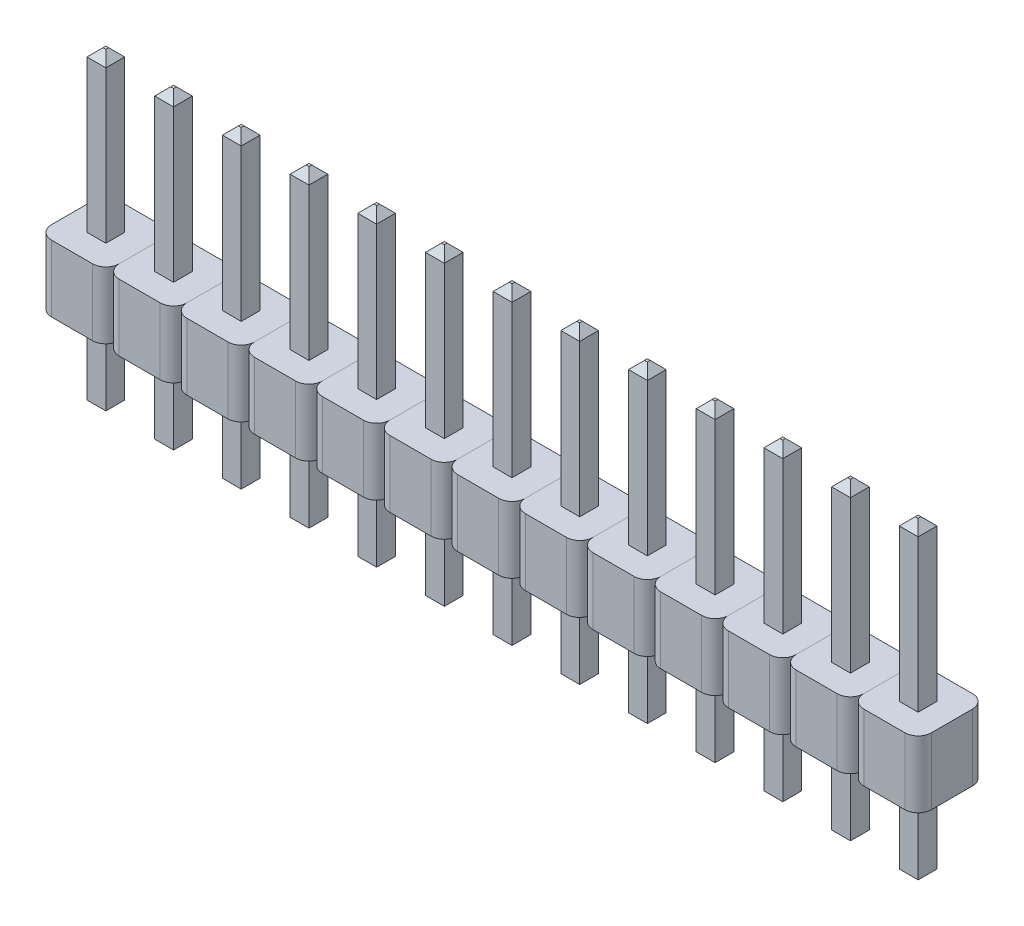
from build123d import *

# Parameters (mm, degrees)
SKETCH1_W                = 2.54
SKETCH1_H                = 2.54
BOSS_EXTRUDE1_DEPTH      = 1.25
FILLET1_R                = 0.5
BOSS_EXTRUDE3_DEPTH      = 3.25
BOSS_EXTRUDE3_DEPTH_BACK = 8.5
SKETCH3_W                = 0.707106782
SKETCH3_H                = 0.707106782
SKETCH4_W                = 0.707106782
SKETCH4_H                = 0.707106782
CUT_EXTRUDE1_DEPTH       = 2.5
CHAMFER3_SIZE            = 0.3
LPATTERN1_COUNT          = 13
LPATTERN1_PITCH          = 2.54


with BuildPart() as part:
    # Sketch1 → Boss-Extrude1 (new, symmetric)
    with BuildSketch(Plane(origin=(0, 0, 0), x_dir=(1, 0, 0), z_dir=(0, 1, 0))):
        Rectangle(SKETCH1_W, SKETCH1_H)
    extrude(amount=BOSS_EXTRUDE1_DEPTH, both=True)

    # Fillet1
    fillet1_edges = [part.edges().sort_by_distance(p)[0] for p in [
        (-1.27, 0, -1.27),
        (1.27, 0, -1.27),
        (-1.27, 0, 1.27),
        (1.27, 0, 1.27),
    ]]
    fillet(fillet1_edges, radius=FILLET1_R)

    # Sketch4 → Cut-Extrude1 (cut)
    with BuildSketch(Plane.XZ.offset(1.25)):
        Rectangle(SKETCH4_W, SKETCH4_H)
    extrude(amount=-CUT_EXTRUDE1_DEPTH, mode=Mode.SUBTRACT)


with BuildPart() as body_2:
    # Sketch3 → Boss-Extrude3 (new, two sides: drawn at the far end of the back side and taken through both)
    with BuildSketch(Plane.XZ.offset(1.25).offset(-BOSS_EXTRUDE3_DEPTH_BACK)):
        Rectangle(SKETCH3_W, SKETCH3_H)
    extrude(amount=BOSS_EXTRUDE3_DEPTH + BOSS_EXTRUDE3_DEPTH_BACK)

    # Chamfer3
    chamfer3_edges = [body_2.edges().sort_by_distance(p)[0] for p in [
        (0, -4.5, 0.353553391),
        (0, 7.25, 0.353553391),
        (-0.353553391, 7.25, 0),
        (0, 7.25, -0.353553391),
        (0.353553391, 7.25, 0),
        (0, -4.5, -0.353553391),
        (-0.353553391, -4.5, 0),
        (0.353553391, -4.5, 0),
    ]]
    chamfer(chamfer3_edges, length=CHAMFER3_SIZE)


with BuildPart() as lpattern1_1:
    # LPattern1: pattern copy
    add(part.part.moved(Location(Vector(1, 0, 0) * (1 * LPATTERN1_PITCH))))


with BuildPart() as lpattern1_2:
    # LPattern1: pattern copy
    add(part.part.moved(Location(Vector(1, 0, 0) * (2 * LPATTERN1_PITCH))))


with BuildPart() as lpattern1_3:
    # LPattern1: pattern copy
    add(part.part.moved(Location(Vector(1, 0, 0) * (3 * LPATTERN1_PITCH))))


with BuildPart() as lpattern1_4:
    # LPattern1: pattern copy
    add(part.part.moved(Location(Vector(1, 0, 0) * (4 * LPATTERN1_PITCH))))


with BuildPart() as lpattern1_5:
    # LPattern1: pattern copy
    add(part.part.moved(Location(Vector(1, 0, 0) * (5 * LPATTERN1_PITCH))))


with BuildPart() as lpattern1_6:
    # LPattern1: pattern copy
    add(part.part.moved(Location(Vector(1, 0, 0) * (6 * LPATTERN1_PITCH))))


with BuildPart() as lpattern1_7:
    # LPattern1: pattern copy
    add(part.part.moved(Location(Vector(1, 0, 0) * (7 * LPATTERN1_PITCH))))


with BuildPart() as lpattern1_8:
    # LPattern1: pattern copy
    add(part.part.moved(Location(Vector(1, 0, 0) * (8 * LPATTERN1_PITCH))))


with BuildPart() as lpattern1_9:
    # LPattern1: pattern copy
    add(part.part.moved(Location(Vector(1, 0, 0) * (9 * LPATTERN1_PITCH))))


with BuildPart() as lpattern1_10:
    # LPattern1: pattern copy
    add(part.part.moved(Location(Vector(1, 0, 0) * (10 * LPATTERN1_PITCH))))


with BuildPart() as lpattern1_11:
    # LPattern1: pattern copy
    add(part.part.moved(Location(Vector(1, 0, 0) * (11 * LPATTERN1_PITCH))))


with BuildPart() as lpattern1_12:
    # LPattern1: pattern copy
    add(part.part.moved(Location(Vector(1, 0, 0) * (12 * LPATTERN1_PITCH))))


with BuildPart() as lpattern1_13:
    # LPattern1: pattern copy
    add(body_2.part.moved(Location(Vector(1, 0, 0) * (1 * LPATTERN1_PITCH))))


with BuildPart() as lpattern1_14:
    # LPattern1: pattern copy
    add(body_2.part.moved(Location(Vector(1, 0, 0) * (2 * LPATTERN1_PITCH))))


with BuildPart() as lpattern1_15:
    # LPattern1: pattern copy
    add(body_2.part.moved(Location(Vector(1, 0, 0) * (3 * LPATTERN1_PITCH))))


with BuildPart() as lpattern1_16:
    # LPattern1: pattern copy
    add(body_2.part.moved(Location(Vector(1, 0, 0) * (4 * LPATTERN1_PITCH))))


with BuildPart() as lpattern1_17:
    # LPattern1: pattern copy
    add(body_2.part.moved(Location(Vector(1, 0, 0) * (5 * LPATTERN1_PITCH))))


with BuildPart() as lpattern1_18:
    # LPattern1: pattern copy
    add(body_2.part.moved(Location(Vector(1, 0, 0) * (6 * LPATTERN1_PITCH))))


with BuildPart() as lpattern1_19:
    # LPattern1: pattern copy
    add(body_2.part.moved(Location(Vector(1, 0, 0) * (7 * LPATTERN1_PITCH))))


with BuildPart() as lpattern1_20:
    # LPattern1: pattern copy
    add(body_2.part.moved(Location(Vector(1, 0, 0) * (8 * LPATTERN1_PITCH))))


with BuildPart() as lpattern1_21:
    # LPattern1: pattern copy
    add(body_2.part.moved(Location(Vector(1, 0, 0) * (9 * LPATTERN1_PITCH))))


with BuildPart() as lpattern1_22:
    # LPattern1: pattern copy
    add(body_2.part.moved(Location(Vector(1, 0, 0) * (10 * LPATTERN1_PITCH))))


with BuildPart() as lpattern1_23:
    # LPattern1: pattern copy
    add(body_2.part.moved(Location(Vector(1, 0, 0) * (11 * LPATTERN1_PITCH))))


with BuildPart() as lpattern1_24:
    # LPattern1: pattern copy
    add(body_2.part.moved(Location(Vector(1, 0, 0) * (12 * LPATTERN1_PITCH))))


solid = Compound([part.part, body_2.part, lpattern1_1.part, lpattern1_2.part, lpattern1_3.part, lpattern1_4.part, lpattern1_5.part, lpattern1_6.part, lpattern1_7.part, lpattern1_8.part, lpattern1_9.part, lpattern1_10.part, lpattern1_11.part, lpattern1_12.part, lpattern1_13.part, lpattern1_14.part, lpattern1_15.part, lpattern1_16.part, lpattern1_17.part, lpattern1_18.part, lpattern1_19.part, lpattern1_20.part, lpattern1_21.part, lpattern1_22.part, lpattern1_23.part, lpattern1_24.part])
